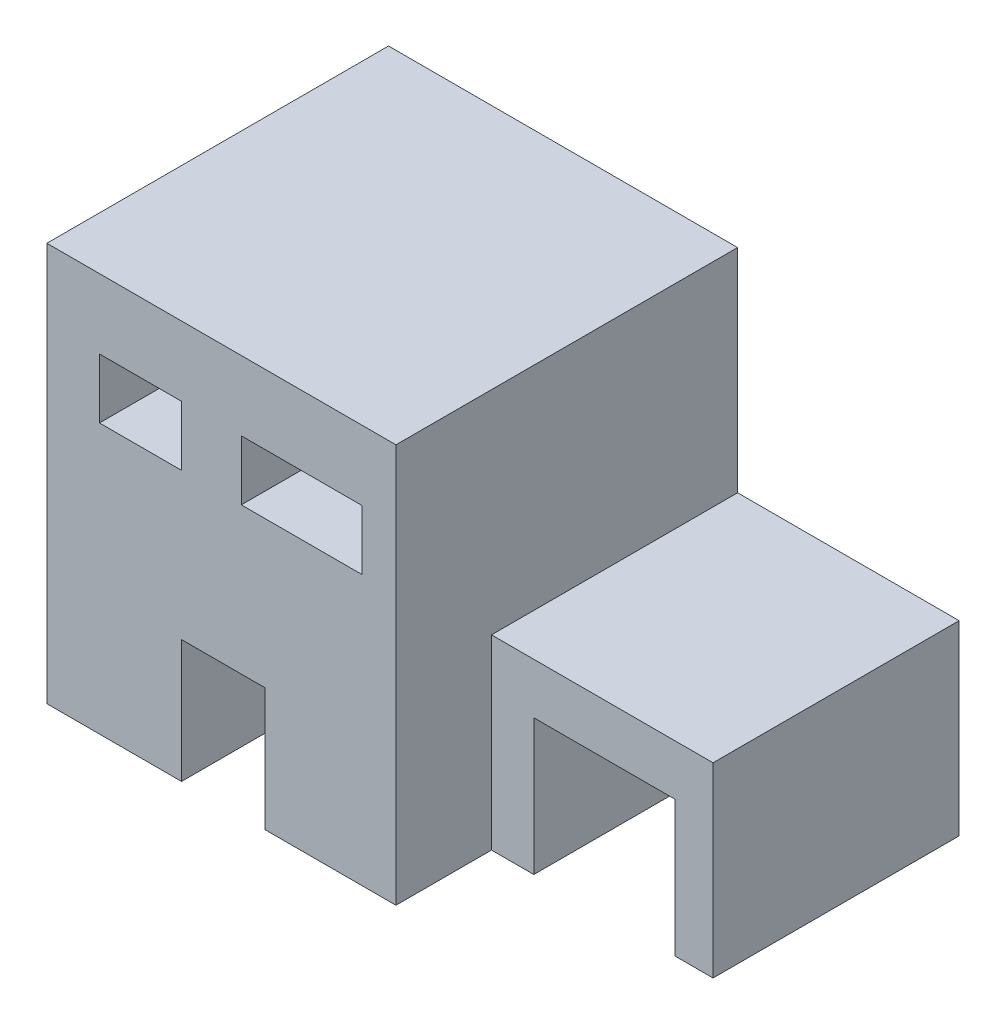
from build123d import *

# Parameters (mm, degrees)
ESQUISSE1_W             = 78.786961771
ESQUISSE1_H             = 77.107895372
BOSS_EXTRU_1_DEPTH      = 90
ESQUISSE3_W             = 55.543823951
ESQUISSE3_H             = 42.068648109
BOSS_EXTRU_3_DEPTH      = 50
ESQUISSE4_W             = 18.786498619
ESQUISSE4_H             = 27.73494317
ESQUISSE4_W_2           = 31.884127938
ESQUISSE4_H_2           = 30.645527463
ESQUISSE4_W_3           = 18.521900048
ESQUISSE4_H_3           = 13.494527178
ESQUISSE4_W_4           = 27.253652927
ENL_V_MAT_EXTRU_1_DEPTH = 110


with BuildPart() as part:
    # Esquisse1 → Boss.-Extru.1 (new body)
    with BuildSketch(Plane(origin=(0, 0, 0), x_dir=(1, 0, 0), z_dir=(0, 1, 0))):
        with Locations((39.393480886, 38.553947686)):
            Rectangle(ESQUISSE1_W, ESQUISSE1_H)
    extrude(amount=BOSS_EXTRU_1_DEPTH)

    # Esquisse3 → Boss.-Extru.3 (add)
    with BuildSketch(Plane(origin=(78.786961771, 0, 0), x_dir=(0, 0, -1), z_dir=(1, 0, 0))):
        with Locations((49.335983396, 21.034324055)):
            Rectangle(ESQUISSE3_W, ESQUISSE3_H)
    extrude(amount=BOSS_EXTRU_3_DEPTH)

    # Esquisse4 → Enlèv. mat.-Extru.1 (cut)
    with BuildSketch(Plane.XY):
        with Locations((39.78581368, 13.867471585)):
            Rectangle(ESQUISSE4_W, ESQUISSE4_H)
        with Locations((104.28171563, 15.322763732)):
            Rectangle(ESQUISSE4_W_2, ESQUISSE4_H_2)
        with Locations((21.131614346, 67.557028272)):
            Rectangle(ESQUISSE4_W_3, ESQUISSE4_H_3)
        with Locations((57.513918011, 67.557028272)):
            Rectangle(ESQUISSE4_W_4, ESQUISSE4_H_3)
    extrude(amount=-ENL_V_MAT_EXTRU_1_DEPTH, mode=Mode.SUBTRACT)


solid = part.part
